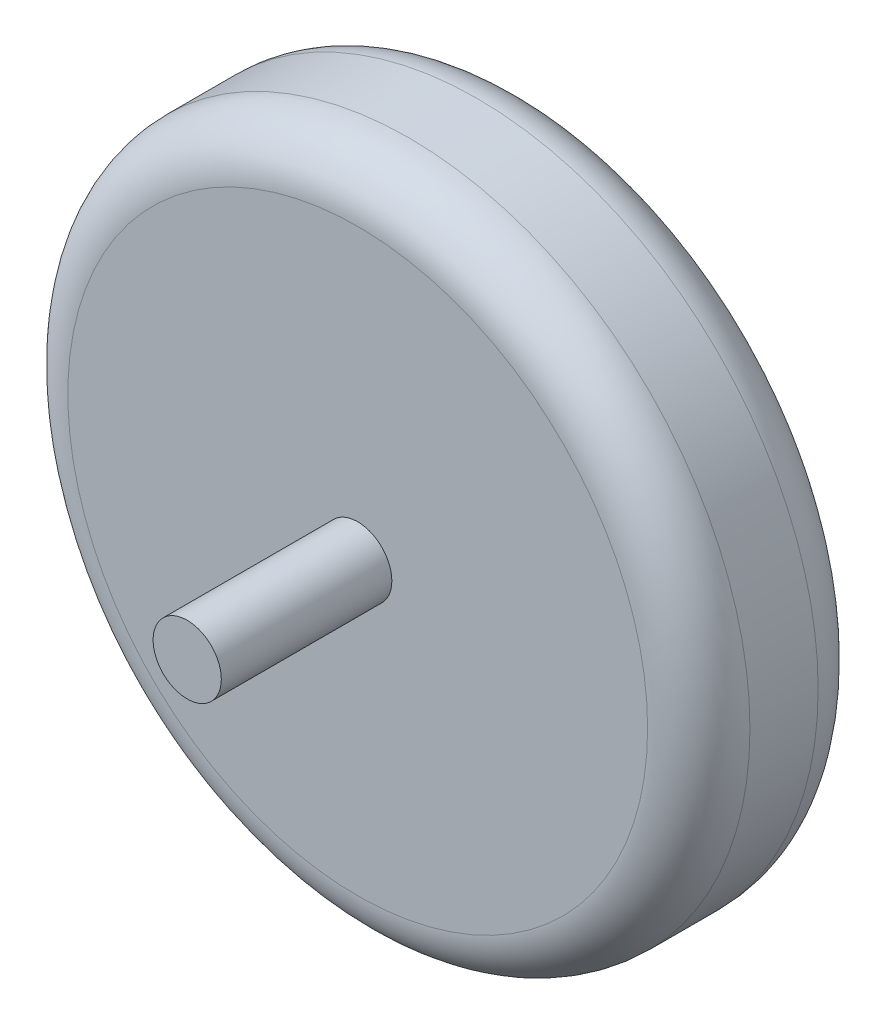
from build123d import *

# Parameters (mm, degrees)
SKETCH_1_R      = 100
EXTRUDE_1_DEPTH = 50
SKETCH_2_R      = 10
EXTRUDE_2_DEPTH = 50
FILLET_1_R      = 15


with BuildPart() as part:
    # 草图1 → 凸台-拉伸1 (new body)
    with BuildSketch(Plane.XY):
        Circle(SKETCH_1_R)
    extrude(amount=EXTRUDE_1_DEPTH)

    # 草图2 → 凸台-拉伸2 (add)
    with BuildSketch(Plane.XY.offset(50)):
        Circle(SKETCH_2_R)
    extrude(amount=EXTRUDE_2_DEPTH)

    # 圆角1
    fillet_1_edges = [part.edges().sort_by_distance(p)[0] for p in [
        (-100, 0, 0),
        (-100, 0, 50),
    ]]
    fillet(fillet_1_edges, radius=FILLET_1_R)


solid = part.part
